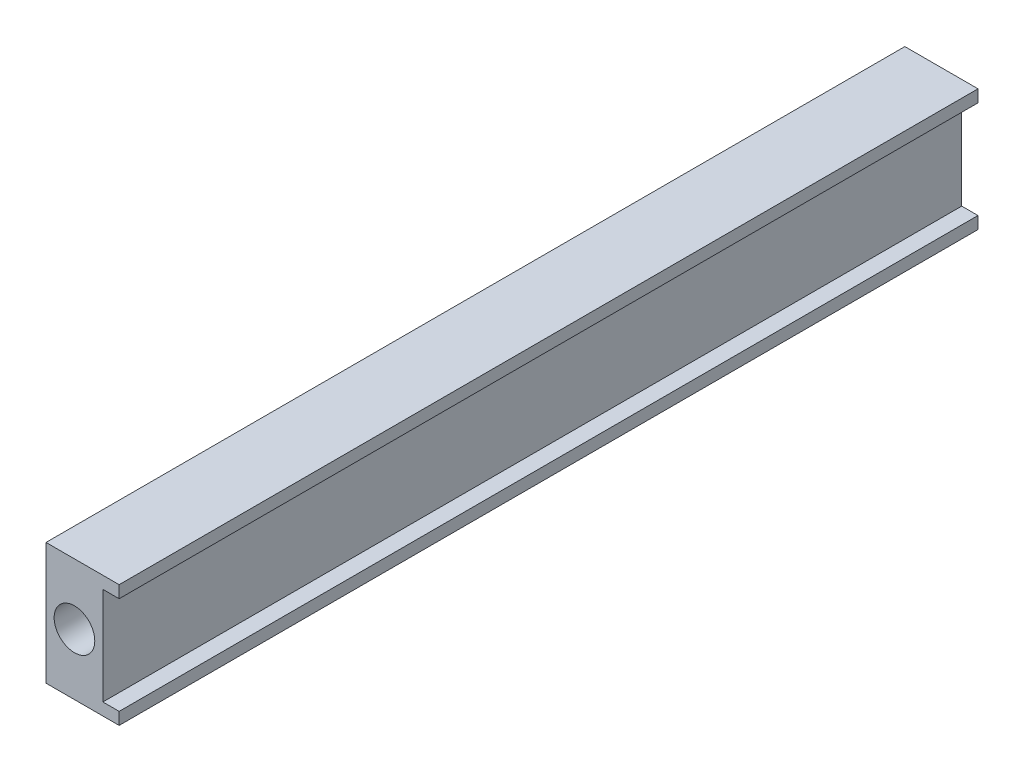
from build123d import *

# Parameters (mm, degrees)
SKETCH2_W           = 18
SKETCH2_H           = 30
BOSS_EXTRUDE1_DEPTH = 211.341
SKETCH3_W           = 4
SKETCH3_H           = 24
CUT_EXTRUDE1_DEPTH  = 1000
SKETCH4_R           = 5
CUT_EXTRUDE2_DEPTH  = 25
CUT_EXTRUDE3_START  = -25
SKETCH5_R           = 5
CUT_EXTRUDE3_DEPTH  = 25


with BuildPart() as part:
    # Sketch2 → Boss-Extrude1 (new body)
    with BuildSketch(Plane.XY):
        with Locations((9, -15)):
            Rectangle(SKETCH2_W, SKETCH2_H)
    extrude(amount=-BOSS_EXTRUDE1_DEPTH)

    # Sketch3 → Cut-Extrude1 (cut)
    with BuildSketch(Plane.XY):
        with Locations((16, -15)):
            Rectangle(SKETCH3_W, SKETCH3_H)
    extrude(amount=-CUT_EXTRUDE1_DEPTH, mode=Mode.SUBTRACT)

    # Sketch4 → Cut-Extrude2 (cut)
    with BuildSketch(Plane.XY):
        with Locations((7, -15)):
            Circle(SKETCH4_R)
    extrude(amount=-CUT_EXTRUDE2_DEPTH, mode=Mode.SUBTRACT)

    # Sketch5 → Cut-Extrude3 (cut)
    with BuildSketch(Plane(origin=(0, 0, -211.341), x_dir=(-1, 0, 0), z_dir=(0, 0, -1)).offset(CUT_EXTRUDE3_START)):
        with Locations(Location((-7, -15, 0), (0, 0, 180))):
            Circle(SKETCH5_R)
    extrude(amount=CUT_EXTRUDE3_DEPTH, mode=Mode.SUBTRACT)


solid = part.part
